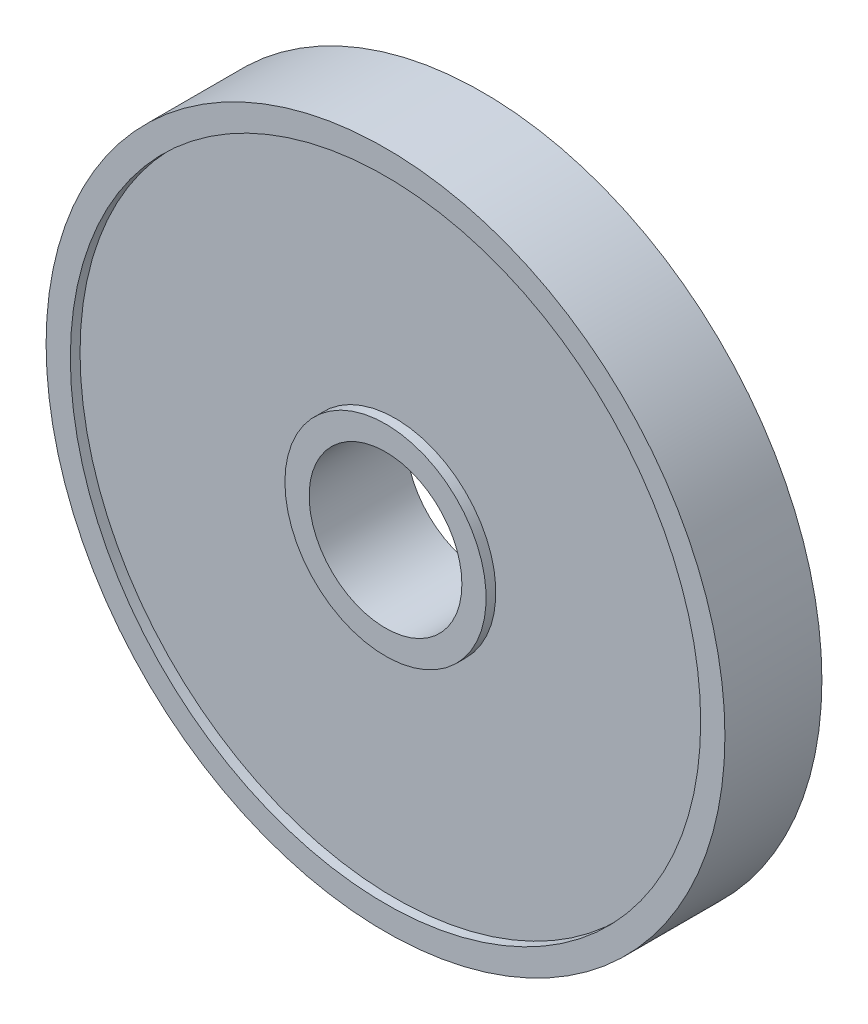
from build123d import *

# Parameters (mm, degrees)
SKIZZE1_R                       = 70
SKIZZE1_R_2                     = 15.75
AUFSATZ_LINEAR_AUSTRAGEN1_DEPTH = 20
SKIZZE2_W                       = 2
SKIZZE2_H                       = 44.25


with BuildPart() as part:
    # Skizze1 → Aufsatz-Linear austragen1 (new body)
    with BuildSketch(Plane.XY):
        Circle(SKIZZE1_R)
        Circle(SKIZZE1_R_2, mode=Mode.SUBTRACT)
    extrude(amount=AUFSATZ_LINEAR_AUSTRAGEN1_DEPTH)

    # Skizze2 → Schnitt-Rotation1 (revolve, cut)
    with BuildSketch(Plane(origin=(0, 0, 0), x_dir=(0, 0, -1), z_dir=(1, 0, 0)), mode=Mode.PRIVATE) as schnitt_rotation1_sk:
        with Locations((-19, 42.875)):
            Rectangle(SKIZZE2_W, SKIZZE2_H)
        with Locations((-1, 42.875)):
            Rectangle(SKIZZE2_W, SKIZZE2_H)
    revolve(schnitt_rotation1_sk.sketch.rotate(Axis((0, 0, 0), (0, 0, 1)), 90), axis=Axis((0, 0, 0), (0, 0, 1)), mode=Mode.SUBTRACT)


solid = part.part
